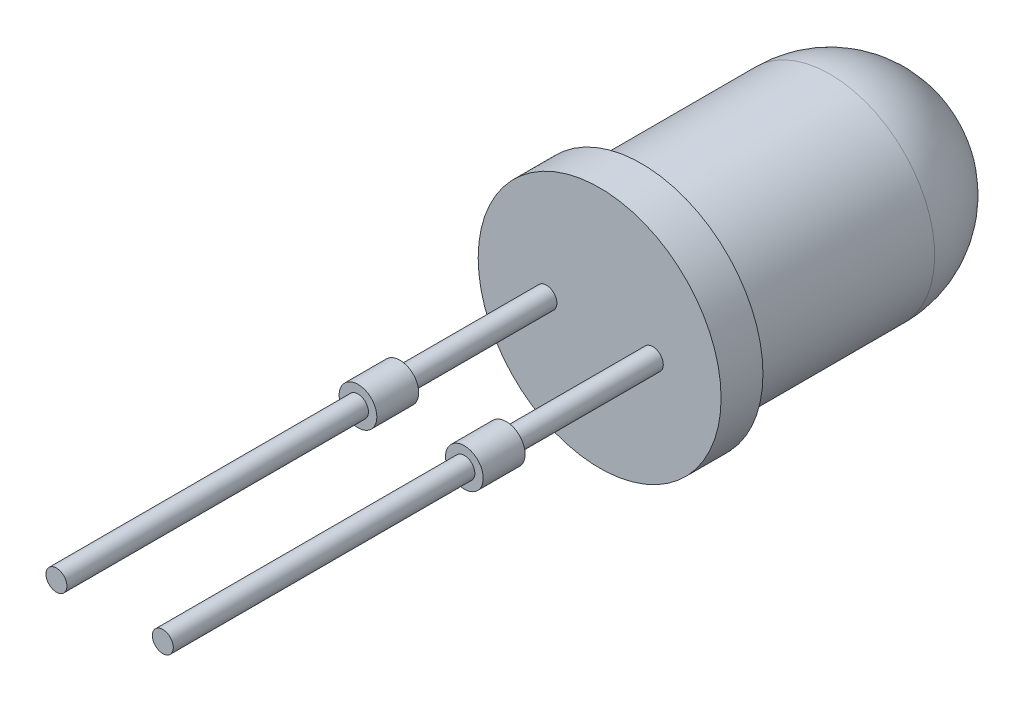
from build123d import *

# Parameters (mm, degrees)
SKETCH_1_R          = 2.5
EXTRUDE_1_DEPTH     = 5.5
SKETCH_2_R          = 2.9
EXTRUDE_2_DEPTH     = 1
SKETCH_3_R          = 0.25
EXTRUDE_3_DEPTH     = 12.7
SKETCH_6_R          = 0.45
SKETCH_6_R_2        = 0.25
EXTRUDE_1_2_DEPTH   = 4.5
SKETCH_7_R          = 0.45
SKETCH_7_R_2        = 0.25
CUT_EXTRUDE_2_DEPTH = 3.5


with BuildPart() as part:
    # 草图1 → Extrude 1 (new body)
    with BuildSketch(Plane.XY):
        Circle(SKETCH_1_R)
    extrude(amount=EXTRUDE_1_DEPTH)

    # 草图2 → 拉伸2 (add)
    with BuildSketch(Plane.XY.offset(5.5)):
        Circle(SKETCH_2_R)
    extrude(amount=-EXTRUDE_2_DEPTH)

    # 草图3 → 拉伸3 (add)
    with BuildSketch(Plane(origin=(0, 0, 4.5), x_dir=(-1, 0, 0), z_dir=(0, 0, -1))):
        with Locations((-1.27, 0)):
            Circle(SKETCH_3_R)
        with Locations(Location((1.27, 0, 0), (0, 0, 180))):
            Circle(SKETCH_3_R)
    extrude(amount=-EXTRUDE_3_DEPTH)

    # 草图5 → 旋转2 (revolve)
    with BuildSketch(Plane(origin=(0, 0, 0), x_dir=(0, 0, -1), z_dir=(1, 0, 0)), mode=Mode.PRIVATE) as revolve_2_sk:
        with BuildLine():
            Line((0, 2.5), (0, 0))
            Line((0, 0), (2.5, 0))
            ThreePointArc((2.5, 0), (1.767766953, 1.767766953), (0, 2.5))
        make_face()
    revolve(revolve_2_sk.sketch.rotate(Axis((0, 0, -2.5), (0, 0, 1)), 90), axis=Axis((0, 0, -2.5), (0, 0, 1)))

    # 草图6 → Extrude 1 2 (add)
    # profile 1 of 2: a face of its own
    with BuildSketch(Plane.XY.offset(5.5)):
        with Locations((-1.27, 0)):
            Circle(SKETCH_6_R)
        with Locations((-1.27, 0)):
            Circle(SKETCH_6_R_2, mode=Mode.SUBTRACT)
    # profile 2 of 2: a face of its own
    with BuildSketch(Plane.XY.offset(5.5)):
        with Locations((1.27, 0)):
            Circle(SKETCH_6_R)
        with Locations(Location((1.27, 0, 0), (0, 0, 180))):
            Circle(SKETCH_6_R_2, mode=Mode.SUBTRACT)
    extrude(amount=EXTRUDE_1_2_DEPTH)

    # 草图7 → 切除-拉伸2 (cut)
    # profile 1 of 2: a face of its own
    with BuildSketch(Plane.XY.offset(5.5)):
        with Locations((-1.27, 0)):
            Circle(SKETCH_7_R)
        with Locations((-1.27, 0)):
            Circle(SKETCH_7_R_2, mode=Mode.SUBTRACT)
    # profile 2 of 2: a face of its own
    with BuildSketch(Plane.XY.offset(5.5)):
        with Locations((1.27, 0)):
            Circle(SKETCH_7_R)
        with Locations((1.27, 0)):
            Circle(SKETCH_7_R_2, mode=Mode.SUBTRACT)
    extrude(amount=CUT_EXTRUDE_2_DEPTH, mode=Mode.SUBTRACT)


solid = part.part
